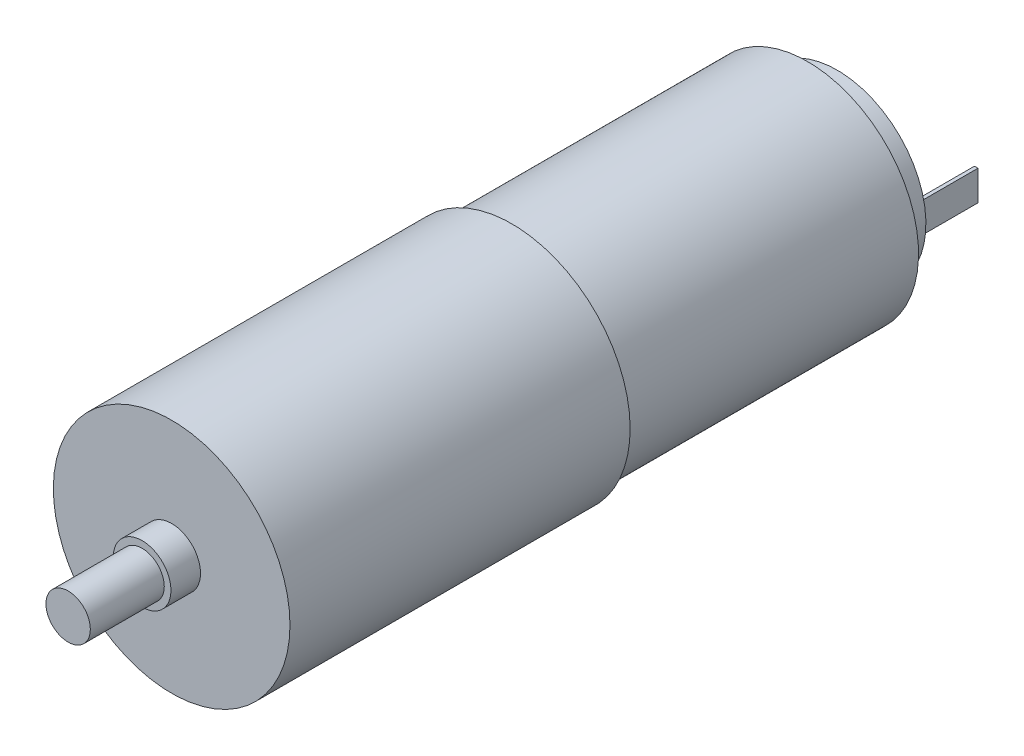
from build123d import *

# Parameters (mm, degrees)
SKETCH_1_R          = 8
EXTRUDE_1_DEPTH     = 23
SKETCH_2_R          = 6
EXTRUDE_2_DEPTH     = 22
SKETCH_4_R          = 1.95
EXTRUDE_4_DEPTH     = 2
SKETCH_5_R          = 7.5
EXTRUDE_6_DEPTH     = 20
CUT_EXTRUDE_2_DEPTH = 25
SKETCH_7_W          = 0.238746812
SKETCH_7_H          = 2.029347906
SKETCH_7_W_2        = 0.208903461
EXTRUDE_7_DEPTH     = 4
SKETCH_8_R          = 1.5
EXTRUDE_8_DEPTH     = 5


with BuildPart() as part:
    # 草图1 → 凸台-拉伸1 (new body)
    with BuildSketch(Plane.XY):
        Circle(SKETCH_1_R)
    extrude(amount=EXTRUDE_1_DEPTH)

    # 草图2 → 凸台-拉伸2 (add)
    with BuildSketch(Plane(origin=(0, 0, 0), x_dir=(-1, 0, 0), z_dir=(0, 0, -1))):
        Circle(SKETCH_2_R)
    extrude(amount=EXTRUDE_2_DEPTH)

    # 草图4 → 凸台-拉伸4 (add)
    with BuildSketch(Plane.XY.offset(23)):
        Circle(SKETCH_4_R)
    extrude(amount=EXTRUDE_4_DEPTH)

    # 草图5 → 凸台-拉伸6 (add)
    with BuildSketch(Plane(origin=(0, 0, 0), x_dir=(-1, 0, 0), z_dir=(0, 0, -1))):
        with Locations(Location((0, 0, 0), (0, 0, 180))):
            Circle(SKETCH_5_R)
    extrude(amount=EXTRUDE_6_DEPTH)

    # 草图6 → 切除-拉伸2 (cut)
    with BuildSketch(Plane(origin=(0, 0, -20), x_dir=(-1, 0, 0), z_dir=(0, 0, -1))):
        Polygon((0, -6), (7.251934426, -6), (7.251934426, -9), (-7.072874317, -9), (-7.072874317, -6), align=None)
    extrude(amount=-CUT_EXTRUDE_2_DEPTH, mode=Mode.SUBTRACT)

    # 草图7 → 凸台-拉伸7 (add)
    with BuildSketch(Plane(origin=(0, 0, -22), x_dir=(-1, 0, 0), z_dir=(0, 0, -1))):
        with Locations((-5.40164663, 0)):
            Rectangle(SKETCH_7_W, SKETCH_7_H)
        with Locations((5.371803278, 0)):
            Rectangle(SKETCH_7_W_2, SKETCH_7_H)
    extrude(amount=EXTRUDE_7_DEPTH)

    # 草图8 → 凸台-拉伸8 (add)
    with BuildSketch(Plane.XY.offset(25)):
        Circle(SKETCH_8_R)
    extrude(amount=EXTRUDE_8_DEPTH)


solid = part.part
